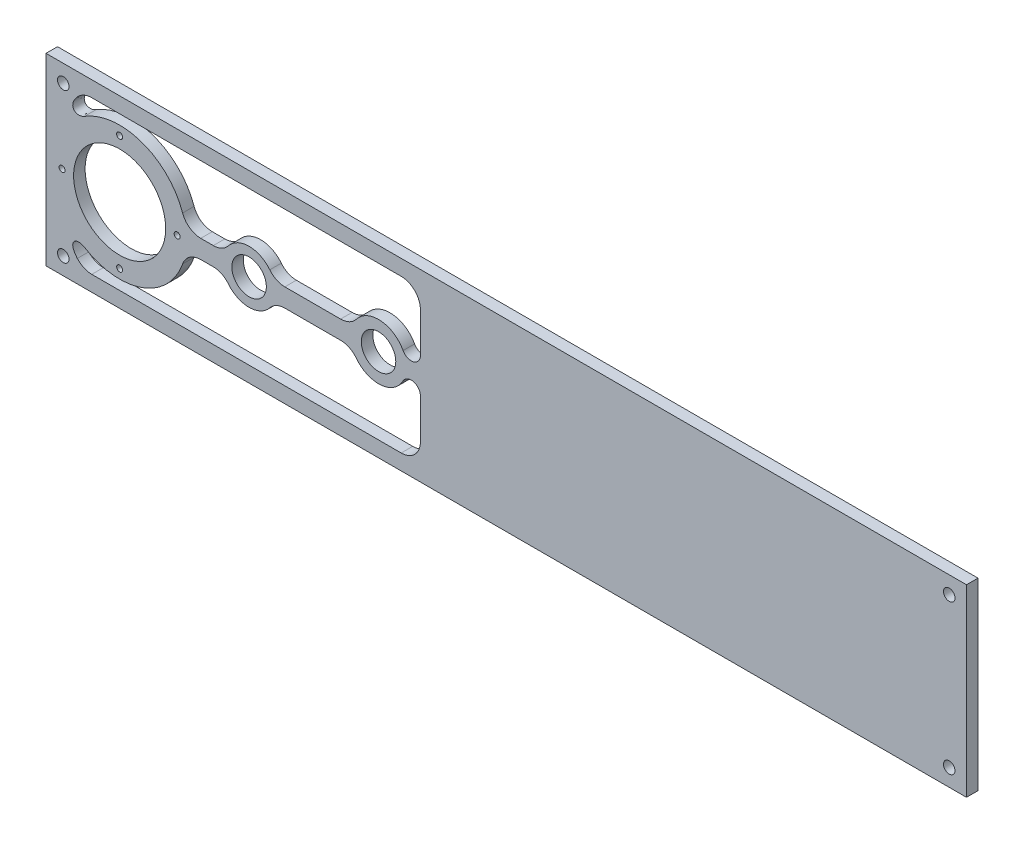
from build123d import *

# Parameters (mm, degrees)
SKETCH1_W           = 508
SKETCH1_H           = 101.6
BOSS_EXTRUDE1_DEPTH = 6.35
SKETCH2_R           = 25.4
SKETCH2_R_2         = 1.651
MOTOR_MOUNT_DEPTH   = 6.35
SKETCH3_R           = 9.525
CUT_EXTRUDE2_DEPTH  = 511.573170564
SKETCH4_R           = 3.175
CUT_EXTRUDE3_DEPTH  = 511.573170564
CUT_EXTRUDE4_DEPTH  = 511.573170564


with BuildPart() as part:
    # Sketch1 → Boss-Extrude1 (new body)
    with BuildSketch(Plane.XY):
        with Locations((254, 0)):
            Rectangle(SKETCH1_W, SKETCH1_H)
    extrude(amount=-BOSS_EXTRUDE1_DEPTH)

    # Sketch2 → Motor mount (cut)
    with BuildSketch(Plane.XY):
        with Locations((40.64, 0)):
            Circle(SKETCH2_R)
        with Locations((72.39, 0)):
            Circle(SKETCH2_R_2)
        with Locations((40.64, -31.75)):
            Circle(SKETCH2_R_2)
        with Locations((8.89, 0)):
            Circle(SKETCH2_R_2)
        with Locations((40.64, 31.75)):
            Circle(SKETCH2_R_2)
    extrude(amount=-MOTOR_MOUNT_DEPTH, mode=Mode.SUBTRACT)

    # Sketch3 → Cut-Extrude2 (cut, through all)
    with BuildSketch(Plane.XY):
        with Locations((112.0775, 0)):
            Circle(SKETCH3_R)
        with Locations((183.515, 0)):
            Circle(SKETCH3_R)
    extrude(amount=-CUT_EXTRUDE2_DEPTH, mode=Mode.SUBTRACT)

    # Sketch4 → Cut-Extrude3 (cut, through all)
    with BuildSketch(Plane.XY):
        with Locations((9.525, 41.275)):
            Circle(SKETCH4_R)
        with Locations((9.525, -41.275)):
            Circle(SKETCH4_R)
        with Locations((498.475, 41.275)):
            Circle(SKETCH4_R)
        with Locations((498.475, -41.275)):
            Circle(SKETCH4_R)
    extrude(amount=-CUT_EXTRUDE3_DEPTH, mode=Mode.SUBTRACT)

    # Sketch7 → Cut-Extrude4 (cut, through all)
    with BuildSketch(Plane.XY):
        with BuildLine():
            Line((85.406292789, 5.08), (92.341412089, 5.08))
            ThreePointArc((92.341412089, 5.08), (96.950572969, 6.134064693), (100.643442411, 9.08671294))
            ThreePointArc((100.643442411, 9.08671294), (112.0775, 14.605), (123.511557589, 9.08671294))
            ThreePointArc((123.511557589, 9.08671294), (127.204427031, 6.134064693), (131.813587911, 5.08))
            Line((131.813587911, 5.08), (162.585112959, 5.08))
            ThreePointArc((162.585112959, 5.08), (167.45975122, 6.214203951), (171.333000793, 9.383818205))
            ThreePointArc((171.333000793, 9.383818205), (184.777760897, 15.325227036), (197.068677539, 7.263261936))
            ThreePointArc((197.068677539, 7.263261936), (202.783248212, 4.735656121), (206.626270766, 9.662753319))
            Line((206.626270766, 9.662753319), (206.626270766, 31.603209647))
            ThreePointArc((206.626270766, 31.603209647), (203.520318205, 39.101642443), (196.02188541, 42.207595003))
            Line((196.02188541, 42.207595003), (25.263102588, 42.207595003))
            ThreePointArc((25.263102588, 42.207595003), (20.881723867, 41.260150637), (17.283250038, 38.587115578))
            add(Edge.make_bspline(
                [(17.283250038, 38.587115578), (11.530533455, 32.014027317), (16.787146308, 28.551640426), (21.263438452, 31.320883809)],
                knots=[0, 0, 0, 0, 1, 1, 1, 1], degree=3))
            ThreePointArc((21.263438452, 31.320883809), (52.918543043, 34.722993545), (75.39838363, 12.177999321))
            ThreePointArc((75.39838363, 12.177999321), (79.271558889, 7.034643814), (85.406292789, 5.08))
        make_face()
    cut_extrude4 = extrude(amount=-CUT_EXTRUDE4_DEPTH, mode=Mode.SUBTRACT)

    # Mirror1: Cut-Extrude4 across plane
    add(cut_extrude4.mirror(Plane.ZX), mode=Mode.SUBTRACT)


solid = part.part
